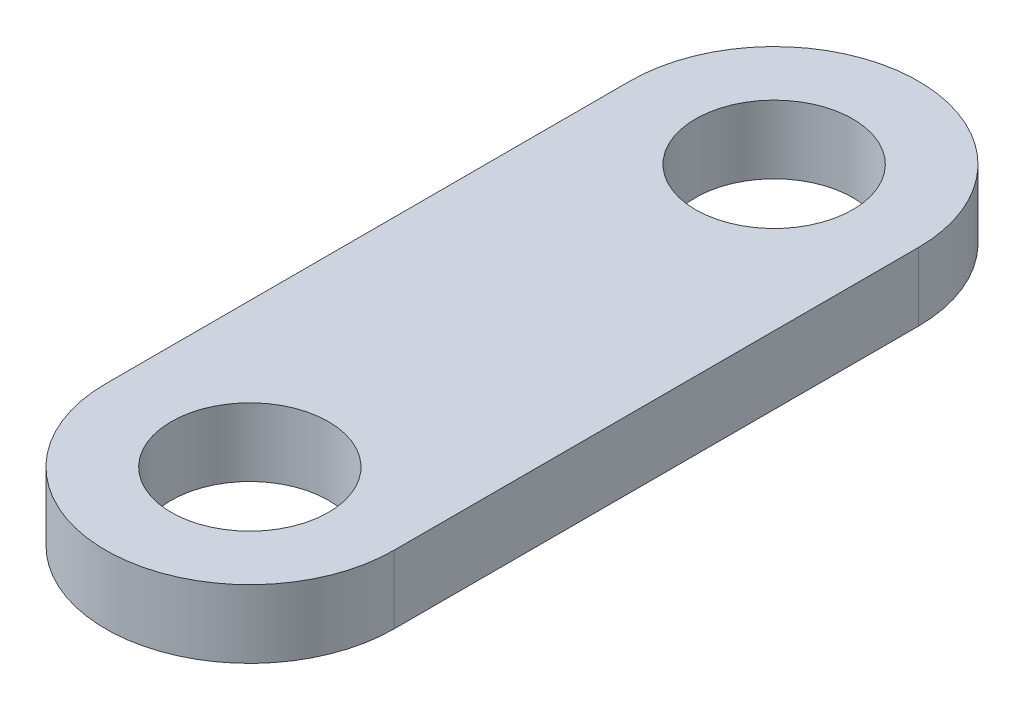
from build123d import *

# Parameters (mm, degrees)
SKETCH_1_R      = 3
EXTRUDE_1_DEPTH = 2.6


with BuildPart() as part:
    # 草图1 → 凸台-拉伸1 (new body)
    with BuildSketch(Plane(origin=(0, 0, 0), x_dir=(1, 0, 0), z_dir=(0, 1, 0))):
        with BuildLine():
            Line((5.5, 10), (5.5, -10))
            ThreePointArc((5.5, -10), (0, -15.5), (-5.5, -10))
            Line((-5.5, -10), (-5.5, 10))
            ThreePointArc((-5.5, 10), (0, 15.5), (5.5, 10))
        make_face()
        with Locations(Location((0, 10, 0), (0, 0, 270))):
            Circle(SKETCH_1_R, mode=Mode.SUBTRACT)
        with Locations(Location((0, -10, 0), (0, 0, 90))):
            Circle(SKETCH_1_R, mode=Mode.SUBTRACT)
    extrude(amount=EXTRUDE_1_DEPTH)


solid = part.part
